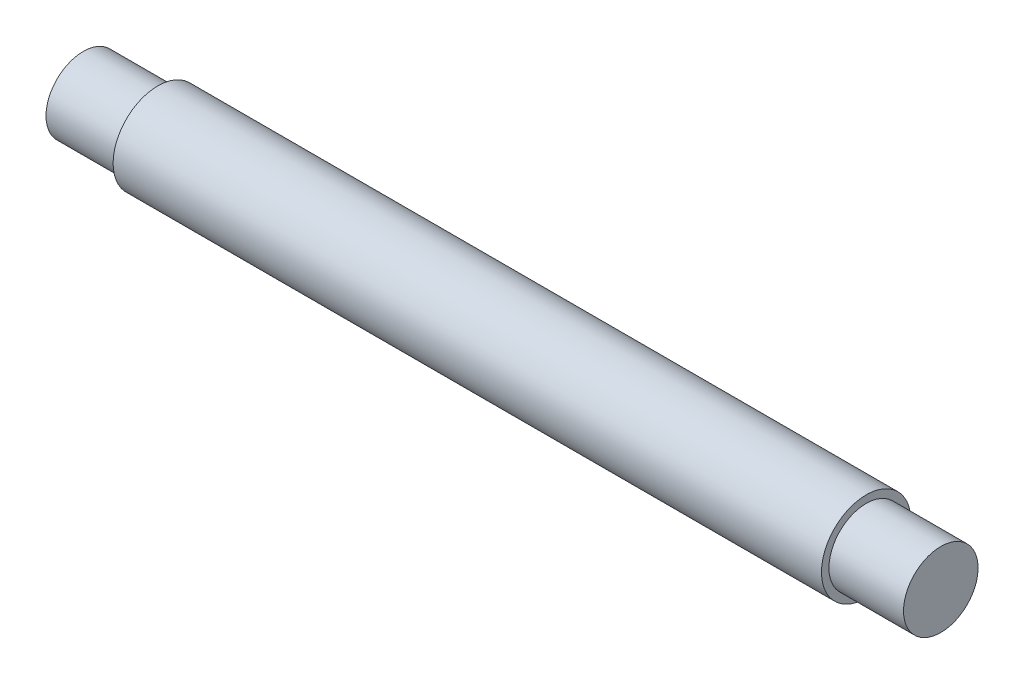
from build123d import *


with BuildPart() as part:
    # Çizim4 → Döndür1 (revolve)
    with BuildSketch(Plane(origin=(0, 0, 0), x_dir=(1, 0, 0), z_dir=(0, 1, 0)), mode=Mode.PRIVATE) as d_nd_r1_sk:
        Polygon((115, 0), (115, 5), (105, 5), (105, 6), (10, 6), (10, 5), (0, 5), (0, 0), align=None)
    revolve(d_nd_r1_sk.sketch.rotate(Axis((0, 0, 0), (1, 0, 0)), 180), axis=Axis((0, 0, 0), (1, 0, 0)))


solid = part.part
